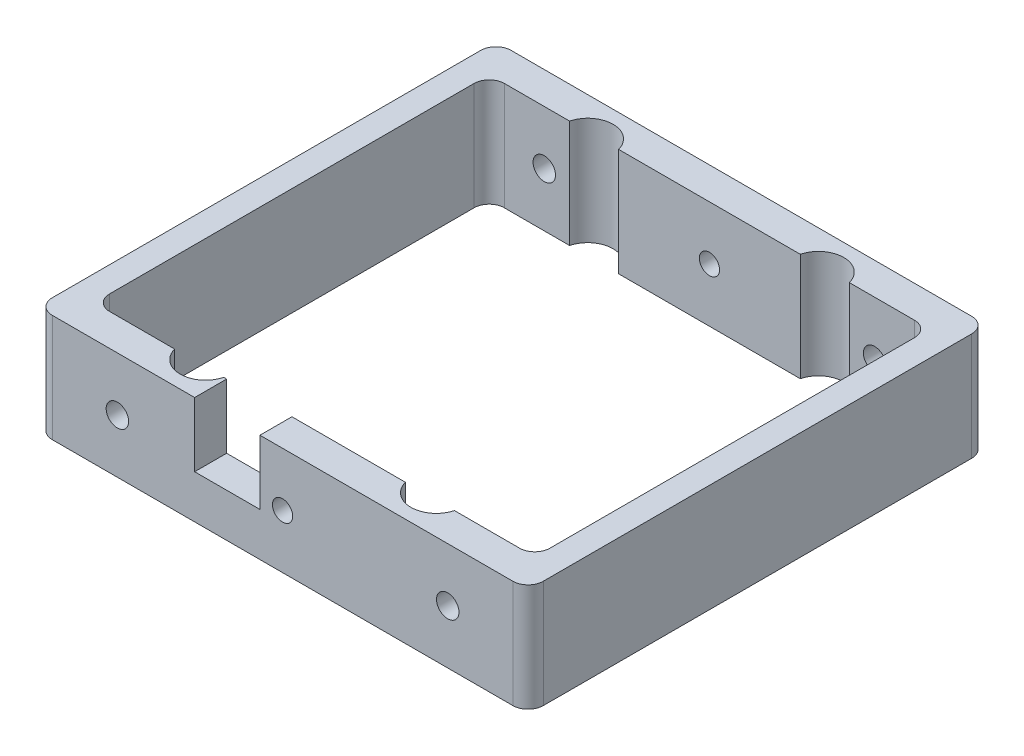
from build123d import *

# Parameters (mm, degrees)
SKETCH1_W           = 60
SKETCH1_H           = 6.32
BOSS_EXTRUDE1_DEPTH = 10.64
SKETCH2_R           = 5
CUT_EXTRUDE1_DEPTH  = 64.974845056
SKETCH3_W           = 6.32
SKETCH3_H           = 21.28
BOSS_EXTRUDE2_DEPTH = 18.5
SKETCH4_W           = 6.32
SKETCH4_H           = 21.28
BOSS_EXTRUDE3_DEPTH = 18.5
SKETCH5_W           = 5
SKETCH5_H           = 21.28
BOSS_EXTRUDE6_DEPTH = 84.33
SKETCH6_W           = 5
SKETCH6_H           = 21.291954735
BOSS_EXTRUDE7_DEPTH = 84.33
SKETCH7_W           = 6.32
SKETCH7_H           = 21.291954735
BOSS_EXTRUDE8_DEPTH = 92
SKETCH9_R           = 5
CUT_EXTRUDE2_DEPTH  = 118.162904694
SKETCH10_R          = 2.22
CUT_EXTRUDE3_DEPTH  = 121.387443862
FILLET1_R           = 3
SKETCH13_R          = 2
CUT_EXTRUDE4_DEPTH  = 121.387443862
SKETCH14_W          = 12.9
SKETCH14_H          = 6.32
CUT_EXTRUDE5_DEPTH  = 12.7


with BuildPart() as part:
    # Sketch1 → Boss-Extrude1 (new, symmetric)
    with BuildSketch(Plane(origin=(0, 0, 0), x_dir=(1, 0, 0), z_dir=(0, 1, 0))):
        with Locations((30, -3.16)):
            Rectangle(SKETCH1_W, SKETCH1_H)
    extrude(amount=BOSS_EXTRUDE1_DEPTH, both=True)

    # Sketch2 → Cut-Extrude1 (cut, through all)
    with BuildSketch(Plane(origin=(0, 10.64, 0), x_dir=(1, 0, 0), z_dir=(0, 1, 0))):
        with Locations((7.21, 1.25)):
            Circle(SKETCH2_R)
        with Locations((52.79, 1.25)):
            Circle(SKETCH2_R)
    extrude(amount=-CUT_EXTRUDE1_DEPTH, mode=Mode.SUBTRACT)

    # Sketch3 → Boss-Extrude2 (add)
    with BuildSketch(Plane(origin=(60, 0, 0), x_dir=(0, 0, -1), z_dir=(1, 0, 0))):
        with Locations((-3.16, 0)):
            Rectangle(SKETCH3_W, SKETCH3_H)
    extrude(amount=BOSS_EXTRUDE2_DEPTH)

    # Sketch4 → Boss-Extrude3 (add)
    with BuildSketch(Plane.ZY):
        with Locations((3.16, 0)):
            Rectangle(SKETCH4_W, SKETCH4_H)
    extrude(amount=BOSS_EXTRUDE3_DEPTH)

    # Sketch5 → Boss-Extrude6 (add)
    with BuildSketch(Plane(origin=(0, 0, 0), x_dir=(-1, 0, 0), z_dir=(0, 0, -1))):
        with Locations((16, 0)):
            Rectangle(SKETCH5_W, SKETCH5_H)
    extrude(amount=BOSS_EXTRUDE6_DEPTH)

    # Sketch6 → Boss-Extrude7 (add)
    with BuildSketch(Plane(origin=(0, 0, 0), x_dir=(-1, 0, 0), z_dir=(0, 0, -1))):
        with Locations((-76, -0.005977367)):
            Rectangle(SKETCH6_W, SKETCH6_H)
    extrude(amount=BOSS_EXTRUDE7_DEPTH)

    # Sketch7 → Boss-Extrude8 (add, through all)
    with BuildSketch(Plane.ZY.offset(-73.5)):
        with Locations((-81.17, -0.005977367)):
            Rectangle(SKETCH7_W, SKETCH7_H)
    extrude(amount=BOSS_EXTRUDE8_DEPTH)

    # Sketch9 → Cut-Extrude2 (cut, through all)
    with BuildSketch(Plane(origin=(0, 10.64, 0), x_dir=(1, 0, 0), z_dir=(0, 1, 0))):
        with Locations((7.21, 76.76)):
            Circle(SKETCH9_R)
        with Locations((52.79, 76.76)):
            Circle(SKETCH9_R)
    extrude(amount=-CUT_EXTRUDE2_DEPTH, mode=Mode.SUBTRACT)

    # Sketch10 → Cut-Extrude3 (cut, through all)
    with BuildSketch(Plane(origin=(0, 0, -84.33), x_dir=(-1, 0, 0), z_dir=(0, 0, -1))):
        with Locations((-62.631229183, 0.005)):
            Circle(SKETCH10_R)
        with Locations((2.631229183, 0.005)):
            Circle(SKETCH10_R)
    extrude(amount=-CUT_EXTRUDE3_DEPTH, mode=Mode.SUBTRACT)

    # Fillet1
    fillet1_edges = [part.edges().sort_by_distance(p)[0] for p in [
        (78.5, 0, 6.32),
        (-18.5, 0, 6.32),
        (-13.5, 0, 0),
        (-18.5, -0.005977367, -84.33),
        (73.5, 0, 0),
        (78.5, -0.005977367, -84.33),
        (-13.5, 0, -78.01),
        (73.5, -0.005977367, -78.01),
    ]]
    fillet(fillet1_edges, radius=FILLET1_R)

    # Sketch13 → Cut-Extrude4 (cut, through all)
    with BuildSketch(Plane(origin=(0, 0, -84.33), x_dir=(-1, 0, 0), z_dir=(0, 0, -1))):
        with Locations((-30, 0.005)):
            Circle(SKETCH13_R)
    extrude(amount=-CUT_EXTRUDE4_DEPTH, mode=Mode.SUBTRACT)

    # Sketch14 → Cut-Extrude5 (cut, symmetric)
    with BuildSketch(Plane(origin=(0, 10.64, 0), x_dir=(1, 0, 0), z_dir=(0, 1, 0))):
        with Locations((19.080701294, -3.16)):
            Rectangle(SKETCH14_W, SKETCH14_H)
    extrude(amount=CUT_EXTRUDE5_DEPTH, both=True, mode=Mode.SUBTRACT)


solid = part.part
